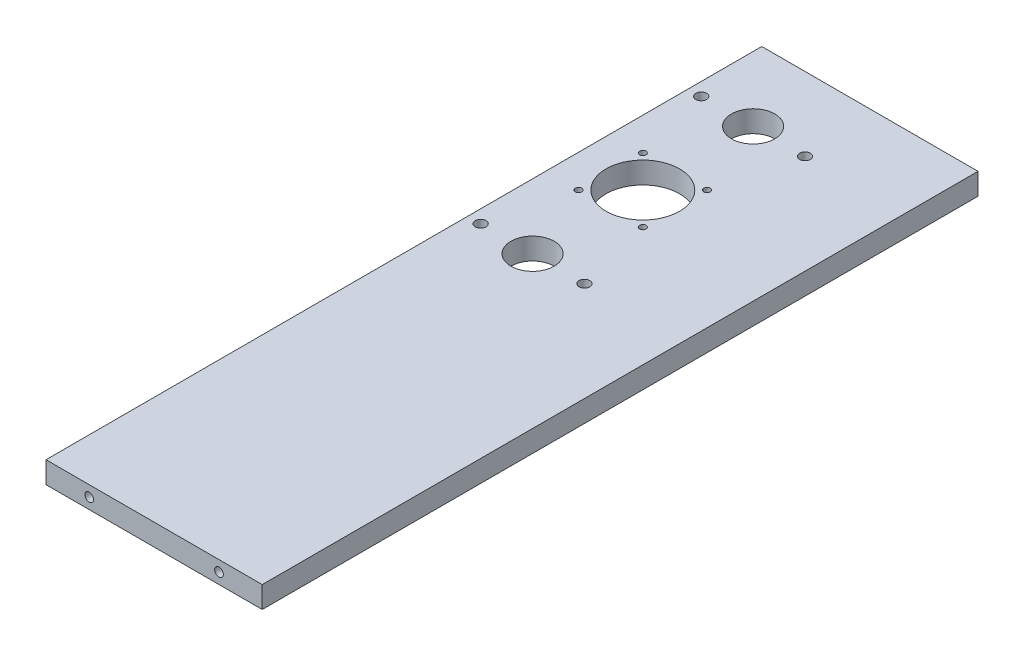
from build123d import *

# Parameters (mm, degrees)
SKETCH1_W           = 100
SKETCH1_H           = 331
BOSS_EXTRUDE1_DEPTH = 10
SKETCH2_R           = 10
SKETCH2_R_2         = 2.5
SKETCH2_R_3         = 17
SKETCH2_R_4         = 1.5
CUT_EXTRUDE1_DEPTH  = 311.286961886
SKETCH3_R           = 2
CUT_EXTRUDE2_DEPTH  = 15


with BuildPart() as part:
    # Sketch1 → Boss-Extrude1 (new body)
    with BuildSketch(Plane(origin=(0, 0, 0), x_dir=(1, 0, 0), z_dir=(0, 1, 0))):
        with Locations((-29.223933498, -134.335900248)):
            Rectangle(SKETCH1_W, SKETCH1_H)
    extrude(amount=BOSS_EXTRUDE1_DEPTH)

    # Sketch2 → Cut-Extrude1 (cut, through all)
    with BuildSketch(Plane(origin=(0, 10, 0), x_dir=(1, 0, 0), z_dir=(0, 1, 0))):
        with Locations(Location((-49.223933498, -2.835900248, 0), (0, 0, 270))):
            Circle(SKETCH2_R)
        with Locations(Location((-73.223933498, -2.835900248, 0), (0, 0, 270))):
            Circle(SKETCH2_R_2)
        with Locations(Location((-25.223933498, -2.835900248, 0), (0, 0, 270))):
            Circle(SKETCH2_R_2)
        with Locations(Location((-49.223933498, -104.835900248, 0), (0, 0, 270))):
            Circle(SKETCH2_R)
        with Locations(Location((-73.223933498, -104.835900248, 0), (0, 0, 270))):
            Circle(SKETCH2_R_2)
        with Locations(Location((-25.223933498, -104.835900248, 0), (0, 0, 270))):
            Circle(SKETCH2_R_2)
        with Locations(Location((-49.223933498, -53.835900248, 0), (0, 0, 270))):
            Circle(SKETCH2_R_3)
        with Locations(Location((-64.073175903, -38.986657843, 0), (0, 0, 270))):
            Circle(SKETCH2_R_4)
        with Locations(Location((-34.374691094, -38.986657843, 0), (0, 0, 270))):
            Circle(SKETCH2_R_4)
        with Locations(Location((-34.374691094, -68.685142653, 0), (0, 0, 270))):
            Circle(SKETCH2_R_4)
        with Locations(Location((-64.073175903, -68.685142653, 0), (0, 0, 270))):
            Circle(SKETCH2_R_4)
    extrude(amount=-CUT_EXTRUDE1_DEPTH, mode=Mode.SUBTRACT)

    # Sketch3 → Cut-Extrude2 (cut)
    with BuildSketch(Plane.XY.offset(299.835900248)):
        with Locations((-59.223933498, 5)):
            Circle(SKETCH3_R)
        with Locations((0.776066502, 5)):
            Circle(SKETCH3_R)
    extrude(amount=-CUT_EXTRUDE2_DEPTH, mode=Mode.SUBTRACT)


solid = part.part
